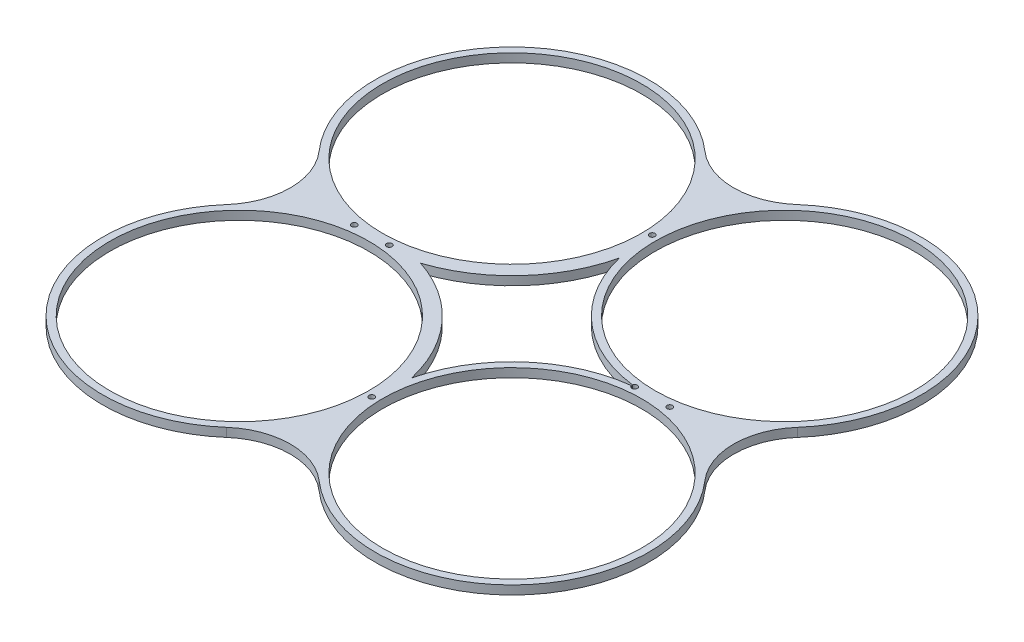
from build123d import *

# Parameters (mm, degrees)
SKETCH_9_R      = 1.6
SKETCH_9_R_2    = 73.9
EXTRUDE_4_DEPTH = 5


with BuildPart() as part:
    # 草图9 → 凸台-拉伸4 (new body)
    with BuildSketch(Plane(origin=(0, 0, 0), x_dir=(1, 0, 0), z_dir=(0, 1, 0))):
        with BuildLine():
            ThreePointArc((136.437456541, -26.366693536), (126.517308136, 0), (136.437456541, 26.366693536))
            ThreePointArc((136.437456541, 26.366693536), (132.936074863, 132.936074863), (26.366693536, 136.437456541))
            ThreePointArc((26.366693536, 136.437456541), (0, 126.517308136), (-26.366693536, 136.437456541))
            ThreePointArc((-26.366693536, 136.437456541), (-132.936074863, 132.936074863), (-136.437456541, 26.366693536))
            ThreePointArc((-136.437456541, 26.366693536), (-126.517308136, 0), (-136.437456541, -26.366693536))
            ThreePointArc((-136.437456541, -26.366693536), (-132.936074863, -132.936074863), (-26.366693536, -136.437456541))
            ThreePointArc((-26.366693536, -136.437456541), (0, -126.517308136), (26.366693536, -136.437456541))
            ThreePointArc((26.366693536, -136.437456541), (132.936074863, -132.936074863), (136.437456541, -26.366693536))
        make_face()
        with Locations(Location((0, -80, 0), (0, 0, 270))):
            Circle(SKETCH_9_R, mode=Mode.SUBTRACT)
        with Locations(Location((-77.781745931, -77.781745931, 0), (0, 0, 270))):
            Circle(SKETCH_9_R_2, mode=Mode.SUBTRACT)
        with Locations(Location((77.781745931, -77.781745931, 0), (0, 0, 270))):
            Circle(SKETCH_9_R_2, mode=Mode.SUBTRACT)
        with Locations(Location((-90, 0, 0), (0, 0, 270))):
            Circle(SKETCH_9_R, mode=Mode.SUBTRACT)
        with Locations(Location((-70, 0, 0), (0, 0, 270))):
            Circle(SKETCH_9_R, mode=Mode.SUBTRACT)
        with Locations(Location((-77.781745931, 77.781745931, 0), (0, 0, 270))):
            Circle(SKETCH_9_R_2, mode=Mode.SUBTRACT)
        with Locations(Location((0, 80, 0), (0, 0, 270))):
            Circle(SKETCH_9_R, mode=Mode.SUBTRACT)
        with BuildLine():
            ThreePointArc((68.43730817, -0.343502905), (26.010818803, -19.439898991), (2.004358454, -59.29424888))
            ThreePointArc((2.004358454, -59.29424888), (-17.301800102, -22.556876962), (-52.137838272, 0))
            ThreePointArc((-52.137838272, 0), (-17.301800102, 22.556876962), (2.004358454, 59.29424888))
            ThreePointArc((2.004358454, 59.29424888), (26.010818803, 19.439898991), (68.43730817, 0.343502905))
            ThreePointArc((68.43730817, 0.343502905), (70.159278325, 1.592052265), (71.599770286, 0.027111489))
            ThreePointArc((71.599770286, 0.027111489), (71.775266864, 0.013357692), (71.950794036, 0))
            ThreePointArc((71.950794036, 0), (71.775266864, -0.013357692), (71.599770286, -0.027111489))
            ThreePointArc((71.599770286, -0.027111489), (70.159278325, -1.592052265), (68.43730817, -0.343502905))
        make_face(mode=Mode.SUBTRACT)
        with Locations(Location((77.781745931, 77.781745931, 0), (0, 0, 270))):
            Circle(SKETCH_9_R_2, mode=Mode.SUBTRACT)
        with Locations(Location((90, 0, 0), (0, 0, 270))):
            Circle(SKETCH_9_R, mode=Mode.SUBTRACT)
    extrude(amount=EXTRUDE_4_DEPTH)


solid = part.part
